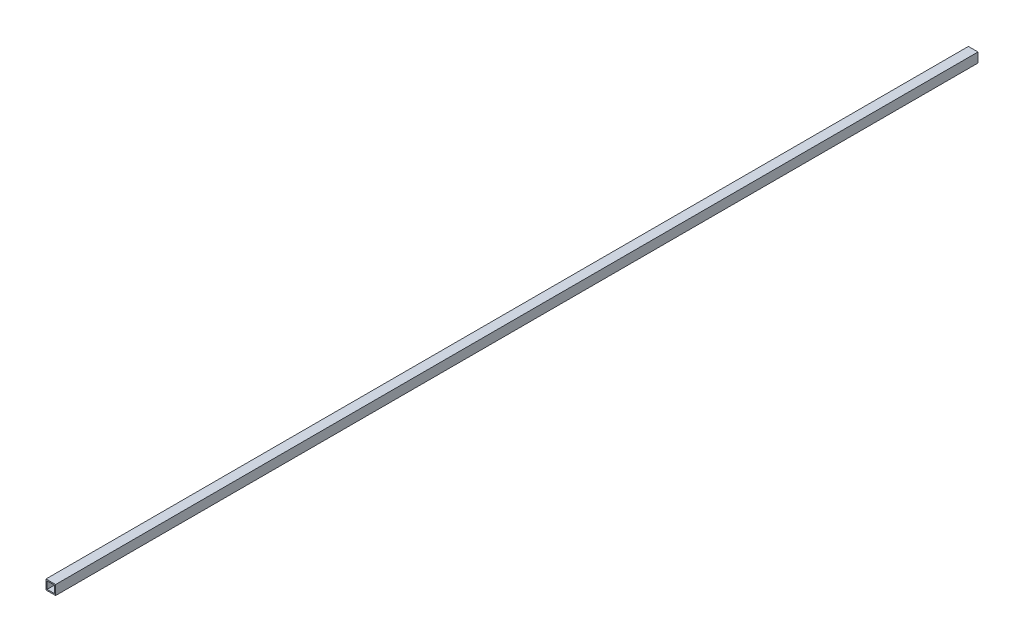
from build123d import *

# Parameters (mm, degrees)
SKETCH1_W           = 25.4
SKETCH1_H           = 25.4
SKETCH1_W_2         = 19.32432
SKETCH1_H_2         = 19.32432
BOSS_EXTRUDE1_DEPTH = 2438.4


with BuildPart() as part:
    # Sketch1 → Boss-Extrude1 (new body)
    with BuildSketch(Plane.XY):
        with Locations((12.7, 12.7)):
            Rectangle(SKETCH1_W, SKETCH1_H)
        with Locations((12.7, 12.7)):
            Rectangle(SKETCH1_W_2, SKETCH1_H_2, mode=Mode.SUBTRACT)
    extrude(amount=BOSS_EXTRUDE1_DEPTH)


solid = part.part
